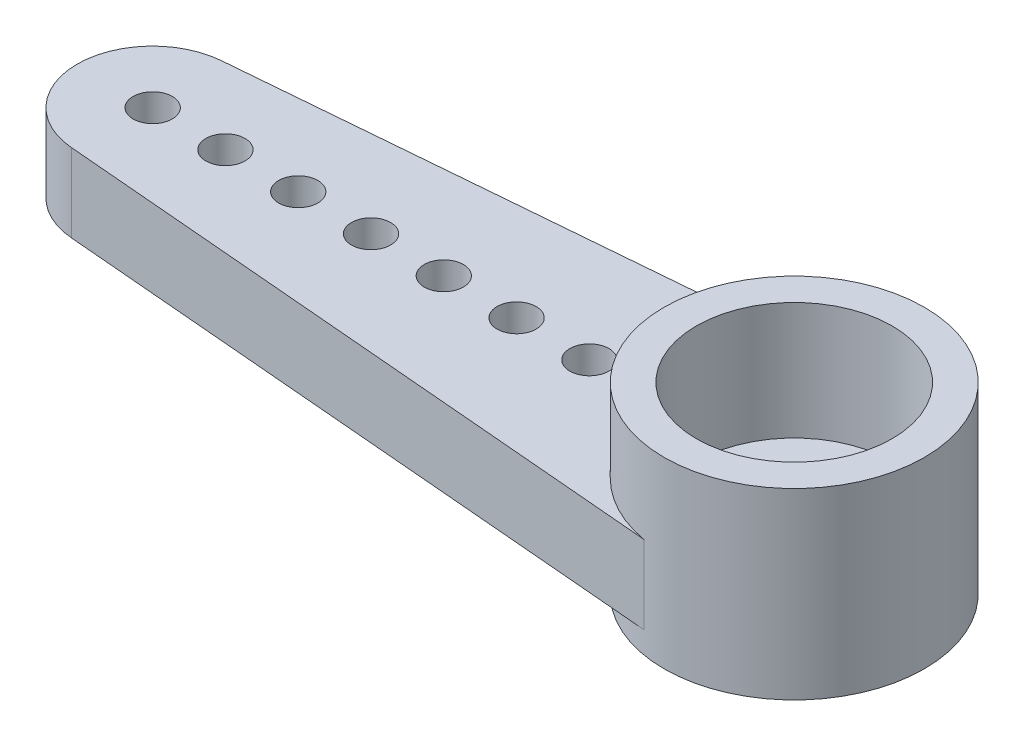
from build123d import *

# Parameters (mm, degrees)
SKETCH_1_R          = 3.325
EXTRUDE_1_DEPTH     = 2.34
SKETCH_2_R          = 2.5
CUT_EXTRUDE_1_DEPTH = 3
SKETCH_3_R          = 1
CUT_EXTRUDE_2_DEPTH = 6.577745961
EXTRUDE_2_DEPTH     = 2
SKETCH_5_R          = 0.5
CUT_EXTRUDE_3_DEPTH = 10


with BuildPart() as part:
    # 草图1 → 凸台-拉伸1 (new, symmetric)
    with BuildSketch(Plane(origin=(0, 0, 0), x_dir=(1, 0, 0), z_dir=(0, 1, 0))):
        with Locations(Location((0, 0, 0), (0, 0, 90))):
            Circle(SKETCH_1_R)
    extrude(amount=EXTRUDE_1_DEPTH, both=True)

    # 草图2 → 切除-拉伸1 (cut)
    with BuildSketch(Plane(origin=(0, 2.34, 0), x_dir=(1, 0, 0), z_dir=(0, 1, 0))):
        with Locations(Location((0, 0, 0), (0, 0, 270))):
            Circle(SKETCH_2_R)
    extrude(amount=-CUT_EXTRUDE_1_DEPTH, mode=Mode.SUBTRACT)

    # 草图3 → 切除-拉伸2 (cut, through all)
    with BuildSketch(Plane(origin=(0, -0.66, 0), x_dir=(1, 0, 0), z_dir=(0, 1, 0))):
        with Locations(Location((0, 0, 0), (0, 0, 270))):
            Circle(SKETCH_3_R)
    extrude(amount=-CUT_EXTRUDE_2_DEPTH, mode=Mode.SUBTRACT)

    # 草图4 → 凸台-拉伸2 (add)
    with BuildSketch(Plane(origin=(0, 0.22, 0), x_dir=(-1, 0, 0), z_dir=(0, -1, 0))):
        with BuildLine():
            Line((0, 3.325), (16.55, 1.92))
            ThreePointArc((16.55, 1.92), (18.325, 0), (16.55, -1.92))
            Line((16.55, -1.92), (0, -3.325))
            ThreePointArc((0, -3.325), (2.566190787, 0), (0, 3.325))
        make_face()
    extrude(amount=EXTRUDE_2_DEPTH)

    # 草图5 → 切除-拉伸3 (cut)
    with BuildSketch(Plane(origin=(0, -1.78, 0), x_dir=(-1, 0, 0), z_dir=(0, -1, 0))):
        with Locations(Location((14.535, 0, 0), (0, 0, 90))):
            Circle(SKETCH_5_R)
        with Locations(Location((16.395, 0, 0), (0, 0, 90))):
            Circle(SKETCH_5_R)
        with Locations(Location((12.675, 0, 0), (0, 0, 90))):
            Circle(SKETCH_5_R)
        with Locations(Location((10.815, 0, 0), (0, 0, 90))):
            Circle(SKETCH_5_R)
        with Locations(Location((8.955, 0, 0), (0, 0, 90))):
            Circle(SKETCH_5_R)
        with Locations(Location((7.095, 0, 0), (0, 0, 90))):
            Circle(SKETCH_5_R)
        with Locations(Location((5.235, 0, 0), (0, 0, 90))):
            Circle(SKETCH_5_R)
    extrude(amount=-CUT_EXTRUDE_3_DEPTH, mode=Mode.SUBTRACT)


solid = part.part
